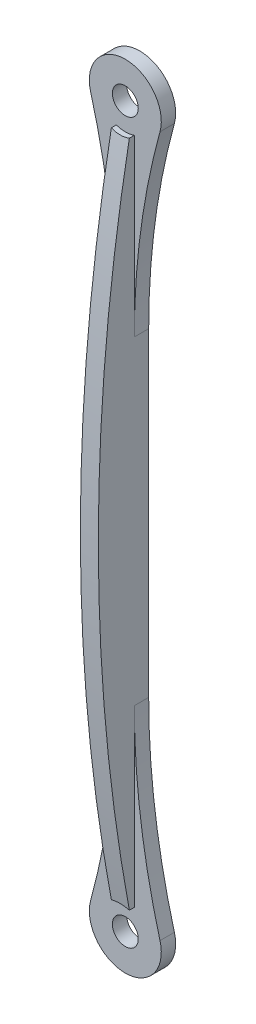
from build123d import *

# Parameters (mm, degrees)
BOSS_EXTRUDE1_DEPTH = 2.54
BOSS_EXTRUDE2_DEPTH = 1.5875
SKETCH4_R           = 4.7625
CUT_EXTRUDE1_DEPTH  = 134.652038892
SKETCH5_R           = 2.286
CUT_EXTRUDE2_DEPTH  = 134.652038897


with BuildPart() as part:
    # Sketch1 → Boss-Extrude1 (new body)
    with BuildSketch(Plane.XY):
        with BuildLine():
            Line((-1.5875, 91.680354705), (-1.5875, 35.319645295))
            ThreePointArc((-1.5875, 35.319645295), (-2.726536461, 18.348556433), (-6.123214286, 1.681887871))
            ThreePointArc((-6.123214286, 1.681887871), (0, -6.35), (6.123214286, 1.681887871))
            ThreePointArc((6.123214286, 1.681887871), (2.726536461, 18.348556433), (1.5875, 35.319645295))
            Line((1.5875, 35.319645295), (1.5875, 91.680354705))
            ThreePointArc((1.5875, 91.680354705), (2.726536461, 108.651443567), (6.123214286, 125.318112129))
            ThreePointArc((6.123214286, 125.318112129), (0, 133.35), (-6.123214286, 125.318112129))
            ThreePointArc((-6.123214286, 125.318112129), (-2.726536461, 108.651443567), (-1.5875, 91.680354705))
        make_face()
    extrude(amount=BOSS_EXTRUDE1_DEPTH)

    # Sketch3 → Boss-Extrude2 (add, symmetric)
    with BuildSketch(Plane(origin=(0, 0, 0), x_dir=(0, 0, -1), z_dir=(1, 0, 0))):
        with BuildLine():
            Line((-2.54, 0), (-2.54, 127))
            ThreePointArc((-2.54, 127), (-8.89, 63.5), (-2.54, 0))
        make_face()
    extrude(amount=BOSS_EXTRUDE2_DEPTH, both=True)

    # Sketch4 → Cut-Extrude1 (cut, through all)
    with BuildSketch(Plane.XY.offset(2.54)):
        Circle(SKETCH4_R)
        with Locations((0, 127)):
            Circle(SKETCH4_R)
    extrude(amount=CUT_EXTRUDE1_DEPTH, mode=Mode.SUBTRACT)

    # Sketch5 → Cut-Extrude2 (cut, through all)
    with BuildSketch(Plane.XY.offset(2.54)):
        Circle(SKETCH5_R)
        with Locations((0, 127)):
            Circle(SKETCH5_R)
    extrude(amount=-CUT_EXTRUDE2_DEPTH, mode=Mode.SUBTRACT)


solid = part.part
